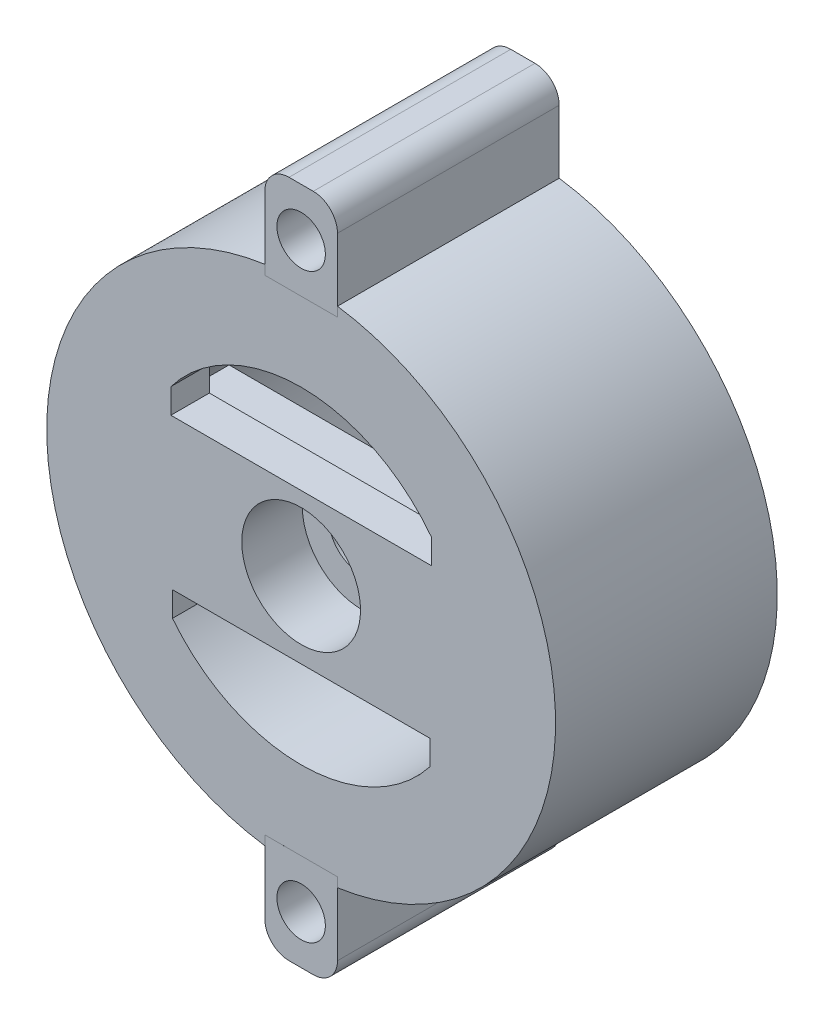
from build123d import *

# Parameters (mm, degrees)
SKETCH1_R               = 21
SKETCH1_R_2             = 13.5
BOSS_EXTRUDE1_DEPTH     = 18.3
BOSS_EXTRUDE3_START     = -3.175
BOSS_EXTRUDE3_DEPTH     = 3.175
SKETCH8_W               = 29.000689647
SKETCH8_H               = 11.495244731
SKETCH8_R               = 2.5875
BOSS_EXTRUDE4_DEPTH     = 3
CUT_EXTRUDE2_DEPTH      = 35.883950464
CUT_EXTRUDE2_DEPTH_BACK = 5
SKETCH7_R               = 4.9
BOSS_EXTRUDE5_START     = -18.3
SKETCH12_W              = 6
SKETCH12_H              = 8
SKETCH12_R              = 2
BOSS_EXTRUDE5_DEPTH     = 18.3001
FILLET1_R               = 2
SKETCH13_W              = 21.503284362
SKETCH13_H              = 2.04991851
SKETCH13_W_2            = 21.237930752
SKETCH13_H_2            = 2.05
CUT_EXTRUDE3_DEPTH      = 10


with BuildPart() as part:
    # Sketch1 → Boss-Extrude1 (new body)
    with BuildSketch(Plane.XY):
        Circle(SKETCH1_R)
        Circle(SKETCH1_R_2, mode=Mode.SUBTRACT)
    extrude(amount=BOSS_EXTRUDE1_DEPTH)

    # Sketch4 → Boss-Extrude3 (add)
    with BuildSketch(Plane.XY.offset(18.3).offset(BOSS_EXTRUDE3_START)):
        with BuildLine():
            Line((10.751642181, 8.164079275), (-10.751642181, 8.164079275))
            ThreePointArc((-10.751642181, 8.164079275), (-13.49956358, -0.10855024), (-10.618965376, -8.335920725))
            Line((-10.618965376, -8.335920725), (10.618965376, -8.335920725))
            ThreePointArc((10.618965376, -8.335920725), (13.49956358, -0.10855024), (10.751642181, 8.164079275))
        make_face()
    extrude(amount=BOSS_EXTRUDE3_DEPTH)

    # Sketch8 → Boss-Extrude4 (add)
    with BuildSketch(Plane.XY.offset(15.125)):
        with Locations((-0.119782029, 0.187903113)):
            Rectangle(SKETCH8_W, SKETCH8_H)
        with Locations((-0.11978203, 0.187903113)):
            Circle(SKETCH8_R, mode=Mode.SUBTRACT)
    extrude(amount=-BOSS_EXTRUDE4_DEPTH)

    # Sketch7 → Cut-Extrude2 (cut, two sides: drawn at the far end of the back side and taken through both)
    with BuildSketch(Plane.XY.offset(18.3).offset(-CUT_EXTRUDE2_DEPTH_BACK)):
        with Locations(Location((0, 0, 0), (0, 0, 180))):
            Circle(SKETCH7_R)
    extrude(amount=CUT_EXTRUDE2_DEPTH + CUT_EXTRUDE2_DEPTH_BACK, mode=Mode.SUBTRACT)

    # Sketch12 → Boss-Extrude5 (add)
    with BuildSketch(Plane.XY.offset(18.3).offset(BOSS_EXTRUDE5_START)):
        with Locations((0, 24)):
            Rectangle(SKETCH12_W, SKETCH12_H)
        with Locations((0, 24)):
            Circle(SKETCH12_R, mode=Mode.SUBTRACT)
    boss_extrude5 = extrude(amount=BOSS_EXTRUDE5_DEPTH)

    # Mirror3: Boss-Extrude5 across plane
    add(boss_extrude5.mirror(Plane.ZX))

    # Fillet1
    fillet1_edges = [part.edges().sort_by_distance(p)[0] for p in [
        (3, 28, 9.15005),
        (-3, 28, 9.15005),
        (-3, -28, 9.15005),
        (3, -28, 9.15005),
    ]]
    fillet(fillet1_edges, radius=FILLET1_R)

    # Sketch13 → Cut-Extrude3 (cut)
    with BuildSketch(Plane.XY.offset(18.3)):
        with Locations((0, 7.13912002)):
            Rectangle(SKETCH13_W, SKETCH13_H)
        with Locations((0, -7.310920725)):
            Rectangle(SKETCH13_W_2, SKETCH13_H_2)
    extrude(amount=-CUT_EXTRUDE3_DEPTH, mode=Mode.SUBTRACT)


solid = part.part
